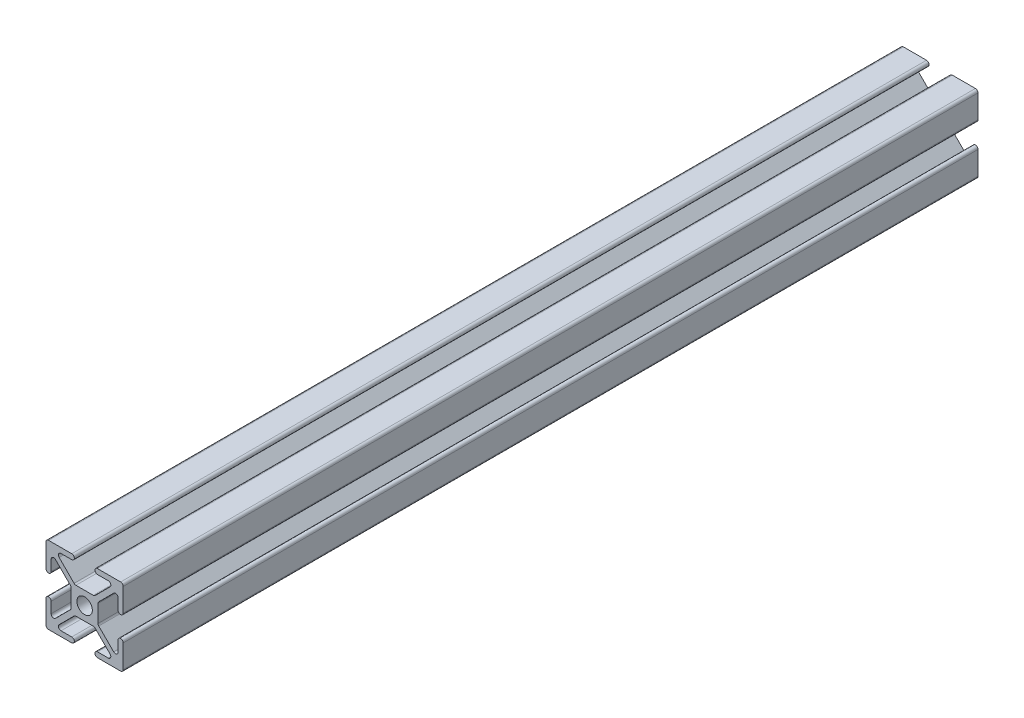
from build123d import *

# Parameters (mm, degrees)
SALIENTE_EXTRUIR1_DEPTH = 332
CROQUIS2_R              = 3
CORTAR_EXTRUIR1_DEPTH   = 333.677020547
CORTAR_EXTRUIR3_DEPTH   = 333.677020547


with BuildPart() as part:
    # Croquis1 → Saliente-Extruir1 (new body)
    with BuildSketch(Plane.XY):
        with BuildLine():
            Line((-14, 15), (14, 15))
            ThreePointArc((14, 15), (14.707106781, 14.707106781), (15, 14))
            Line((15, 14), (15, -14))
            ThreePointArc((15, -14), (14.707106781, -14.707106781), (14, -15))
            Line((14, -15), (-14, -15))
            ThreePointArc((-14, -15), (-14.707106781, -14.707106781), (-15, -14))
            Line((-15, -14), (-15, 14))
            ThreePointArc((-15, 14), (-14.707106781, 14.707106781), (-14, 15))
        make_face()
    extrude(amount=-SALIENTE_EXTRUIR1_DEPTH)

    # Croquis2 → Cortar-Extruir1 (cut, through all)
    with BuildSketch(Plane.XY):
        Circle(CROQUIS2_R)
    extrude(amount=-CORTAR_EXTRUIR1_DEPTH, mode=Mode.SUBTRACT)

    # Croquis3 → Cortar-Extruir3 (cut, through all)
    with BuildSketch(Plane.XY):
        with BuildLine():
            Line((-5.492893219, 4.078679656), (-11.292893219, 9.878679656))
            ThreePointArc((-11.292893219, 9.878679656), (-12.382683432, 10.095452408), (-13, 9.171572875))
            Line((-13, 9.171572875), (-13, 5))
            ThreePointArc((-13, 5), (-14, 4), (-15, 5))
            Line((-15, 5), (-15, -5))
            ThreePointArc((-15, -5), (-14, -4), (-13, -5))
            Line((-13, -5), (-13, -9.171572875))
            ThreePointArc((-13, -9.171572875), (-12.382683432, -10.095452408), (-11.292893219, -9.878679656))
            Line((-11.292893219, -9.878679656), (-5.492893219, -4.078679656))
            ThreePointArc((-5.492893219, -4.078679656), (-5.276120467, -3.754256308), (-5.2, -3.371572875))
            Line((-5.2, -3.371572875), (-5.2, 3.371572875))
            ThreePointArc((-5.2, 3.371572875), (-5.276120467, 3.754256308), (-5.492893219, 4.078679656))
        make_face()
        with BuildLine():
            ThreePointArc((-9.171572875, 13), (-10.095452408, 12.382683432), (-9.878679656, 11.292893219))
            Line((-9.878679656, 11.292893219), (-4.078679656, 5.492893219))
            ThreePointArc((-4.078679656, 5.492893219), (-3.754256308, 5.276120467), (-3.371572875, 5.2))
            Line((-3.371572875, 5.2), (3.371572875, 5.2))
            ThreePointArc((3.371572875, 5.2), (3.754256308, 5.276120467), (4.078679656, 5.492893219))
            Line((4.078679656, 5.492893219), (9.878679656, 11.292893219))
            ThreePointArc((9.878679656, 11.292893219), (10.095452408, 12.382683432), (9.171572875, 13))
            Line((9.171572875, 13), (5, 13))
            ThreePointArc((5, 13), (4, 14), (5, 15))
            Line((5, 15), (-5, 15))
            ThreePointArc((-5, 15), (-4.292893219, 14.707106781), (-4, 14))
            ThreePointArc((-4, 14), (-4.292893219, 13.292893219), (-5, 13))
            Line((-5, 13), (-9.171572875, 13))
        make_face()
        with BuildLine():
            Line((9.878679656, -11.292893219), (4.078679656, -5.492893219))
            ThreePointArc((4.078679656, -5.492893219), (3.754256308, -5.276120467), (3.371572875, -5.2))
            Line((3.371572875, -5.2), (-3.371572875, -5.2))
            ThreePointArc((-3.371572875, -5.2), (-3.754256308, -5.276120467), (-4.078679656, -5.492893219))
            Line((-4.078679656, -5.492893219), (-9.878679656, -11.292893219))
            ThreePointArc((-9.878679656, -11.292893219), (-10.095452408, -12.382683432), (-9.171572875, -13))
            Line((-9.171572875, -13), (-5, -13))
            ThreePointArc((-5, -13), (-4.292893219, -13.292893219), (-4, -14))
            ThreePointArc((-4, -14), (-4.292893219, -14.707106781), (-5, -15))
            Line((-5, -15), (5, -15))
            ThreePointArc((5, -15), (4, -14), (5, -13))
            Line((5, -13), (9.171572875, -13))
            ThreePointArc((9.171572875, -13), (10.095452408, -12.382683432), (9.878679656, -11.292893219))
        make_face()
        with BuildLine():
            ThreePointArc((13, 9.171572875), (12.382683432, 10.095452408), (11.292893219, 9.878679656))
            Line((11.292893219, 9.878679656), (5.492893219, 4.078679656))
            ThreePointArc((5.492893219, 4.078679656), (5.276120467, 3.754256308), (5.2, 3.371572875))
            Line((5.2, 3.371572875), (5.2, -3.371572875))
            ThreePointArc((5.2, -3.371572875), (5.276120467, -3.754256308), (5.492893219, -4.078679656))
            Line((5.492893219, -4.078679656), (11.292893219, -9.878679656))
            ThreePointArc((11.292893219, -9.878679656), (12.382683432, -10.095452408), (13, -9.171572875))
            Line((13, -9.171572875), (13, -5))
            ThreePointArc((13, -5), (14, -4), (15, -5))
            Line((15, -5), (15, 5))
            ThreePointArc((15, 5), (14, 4), (13, 5))
            Line((13, 5), (13, 9.171572875))
        make_face()
    extrude(amount=-CORTAR_EXTRUIR3_DEPTH, mode=Mode.SUBTRACT)


solid = part.part
